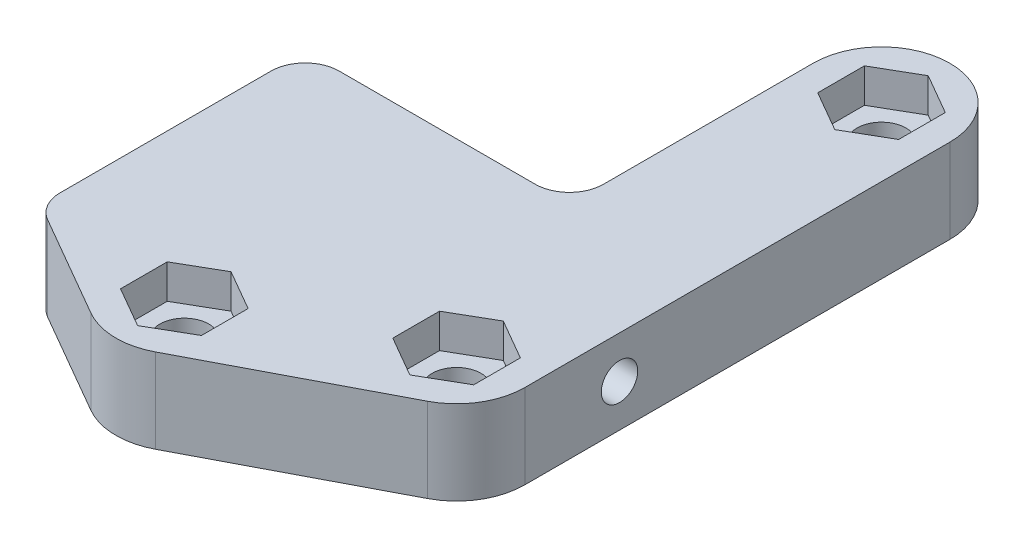
from build123d import *

# Parameters (mm, degrees)
SKETCH2_R               = 2.15
BOSS_EXTRUDE1_DEPTH     = 7.4
CUT_EXTRUDE4_DEPTH      = 49.713080647
CUT_EXTRUDE4_DEPTH_BACK = 49.713080647
SKETCH3_R               = 1.6
CUT_EXTRUDE1_DEPTH      = 3
CUT_EXTRUDE5_DEPTH      = 41.060132627
FILLET1_R               = 3


with BuildPart() as part:
    # Sketch2 → Boss-Extrude1 (new body)
    with BuildSketch(Plane(origin=(0, 0, 0), x_dir=(1, 0, 0), z_dir=(0, 1, 0))):
        with BuildLine():
            Line((-13.5, -25.984609691), (-3, -32.046787517))
            ThreePointArc((-3, -32.046787517), (-0.126819274, -32.849294684), (2.777711124, -32.168935661))
            Line((2.777711124, -32.168935661), (18.477711124, -23.968935661))
            ThreePointArc((18.477711124, -23.968935661), (20.831581956, -21.759793603), (21.7, -18.650635095))
            Line((21.7, -18.650635095), (21.7, 18.650635095))
            ThreePointArc((21.7, 18.650635095), (19.942640687, 22.893275782), (15.7, 24.650635095))
            Line((15.7, 24.650635095), (11.5, 24.650635095))
            Line((11.5, 24.650635095), (-13.5, 24.650635095))
            Line((-13.5, 24.650635095), (-13.5, -22.650635095))
            Line((-13.5, -22.650635095), (-13.5, -25.984609691))
        make_face()
        with Locations(Location((0, -26.850635095, 0), (0, 0, 270))):
            Circle(SKETCH2_R, mode=Mode.SUBTRACT)
        with Locations(Location((15.7, -18.650635095, 0), (0, 0, 270))):
            Circle(SKETCH2_R, mode=Mode.SUBTRACT)
        with Locations(Location((15.7, 18.650635095, 0), (0, 0, 270))):
            Circle(SKETCH2_R, mode=Mode.SUBTRACT)
    extrude(amount=BOSS_EXTRUDE1_DEPTH)

    # Sketch3 → Cut-Extrude4 (cut, two sides: drawn at the far end of the back side and taken through both)
    with BuildSketch(Plane.ZY.offset(-21.7).offset(-CUT_EXTRUDE4_DEPTH_BACK)):
        with Locations((10.349364905, 3.7)):
            Circle(SKETCH3_R)
    extrude(amount=CUT_EXTRUDE4_DEPTH + CUT_EXTRUDE4_DEPTH_BACK, mode=Mode.SUBTRACT)

    # Sketch4 → Cut-Extrude1 (cut)
    with BuildSketch(Plane.XZ.offset(-7.4)):
        Polygon((0, 22.751448183), (3.55, 24.801041639), (3.55, 28.90022855), (0, 30.949822006), (-3.55, 28.90022855), (-3.55, 24.801041639), align=None)
        Polygon((15.7, 14.551448183), (19.25, 16.601041639), (19.25, 20.70022855), (15.7, 22.749822006), (12.15, 20.70022855), (12.15, 16.601041639), align=None)
        Polygon((12.15, -20.70022855), (15.7, -22.749822006), (19.25, -20.70022855), (19.25, -16.601041639), (15.7, -14.551448183), (12.15, -16.601041639), align=None)
    extrude(amount=CUT_EXTRUDE1_DEPTH, mode=Mode.SUBTRACT)

    # Sketch5 → Cut-Extrude5 (cut, through all)
    with BuildSketch(Plane(origin=(0, 7.4, 0), x_dir=(1, 0, 0), z_dir=(0, 1, 0))):
        with BuildLine():
            Line((-13.5, 24.650635095), (-13.5, -2.749364905))
            Line((-13.5, -2.749364905), (9.7, -2.749364905))
            Line((9.7, -2.749364905), (9.7, 18.650635095))
            ThreePointArc((9.7, 18.650635095), (11.457359313, 22.893275782), (15.7, 24.650635095))
            Line((15.7, 24.650635095), (-13.5, 24.650635095))
        make_face()
    extrude(amount=-CUT_EXTRUDE5_DEPTH, mode=Mode.SUBTRACT)

    # Fillet1
    fillet1_edges = [part.edges().sort_by_distance(p)[0] for p in [
        (9.7, 3.7, 2.749364905),
        (-13.5, 3.7, 2.749364905),
        (-13.5, 3.7, 25.984609691),
    ]]
    fillet(fillet1_edges, radius=FILLET1_R)


solid = part.part
